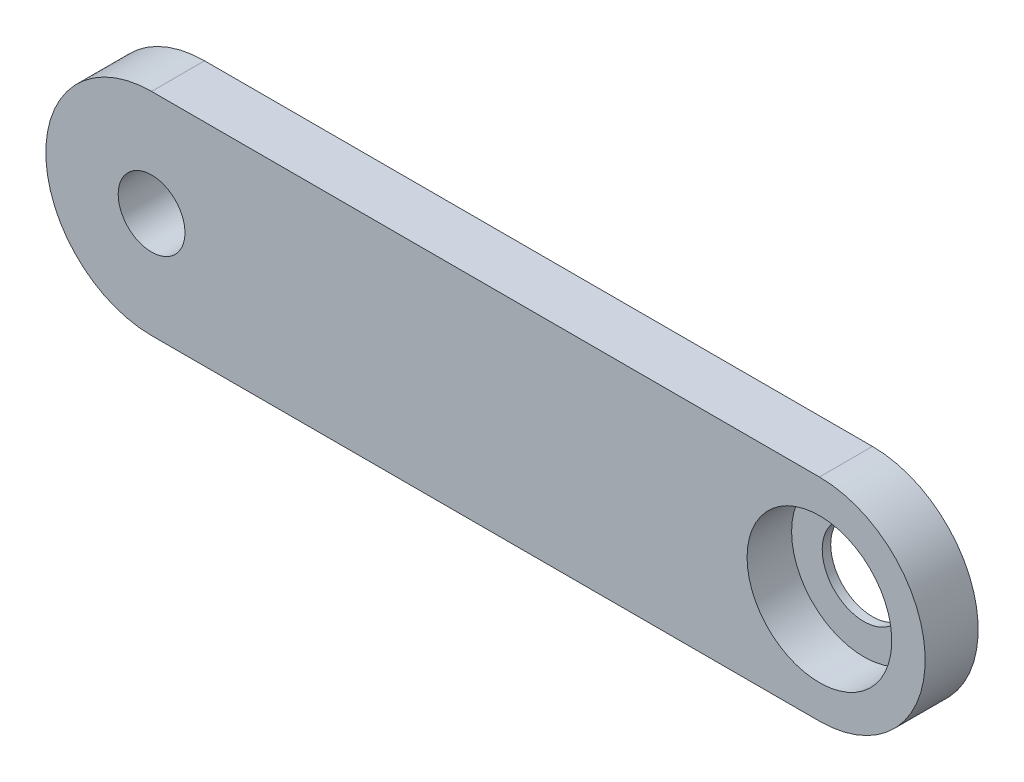
from build123d import *

# Parameters (mm, degrees)
CROQUIS1_R              = 6
CROQUIS1_R_2            = 13
SALIENTE_EXTRUIR1_DEPTH = 9.525
CROQUIS2_R              = 13
CROQUIS2_R_2            = 7.5
SALIENTE_EXTRUIR2_DEPTH = 1.525


with BuildPart() as part:
    # Croquis1 → Saliente-Extruir1 (new body)
    with BuildSketch(Plane.XY):
        with BuildLine():
            Line((0, 19), (120, 19))
            ThreePointArc((120, 19), (139, 0), (120, -19))
            Line((120, -19), (0, -19))
            ThreePointArc((0, -19), (-19, 0), (0, 19))
        make_face()
        with Locations(Location((0, 0, 0), (0, 0, 180))):
            Circle(CROQUIS1_R, mode=Mode.SUBTRACT)
        with Locations(Location((120, 0, 0), (0, 0, 180))):
            Circle(CROQUIS1_R_2, mode=Mode.SUBTRACT)
    extrude(amount=SALIENTE_EXTRUIR1_DEPTH)

    # Croquis2 → Saliente-Extruir2 (add)
    with BuildSketch(Plane(origin=(0, 0, 0), x_dir=(-1, 0, 0), z_dir=(0, 0, -1))):
        with Locations((-120, 0)):
            Circle(CROQUIS2_R)
        with Locations((-120, 0)):
            Circle(CROQUIS2_R_2, mode=Mode.SUBTRACT)
    extrude(amount=-SALIENTE_EXTRUIR2_DEPTH)


solid = part.part
